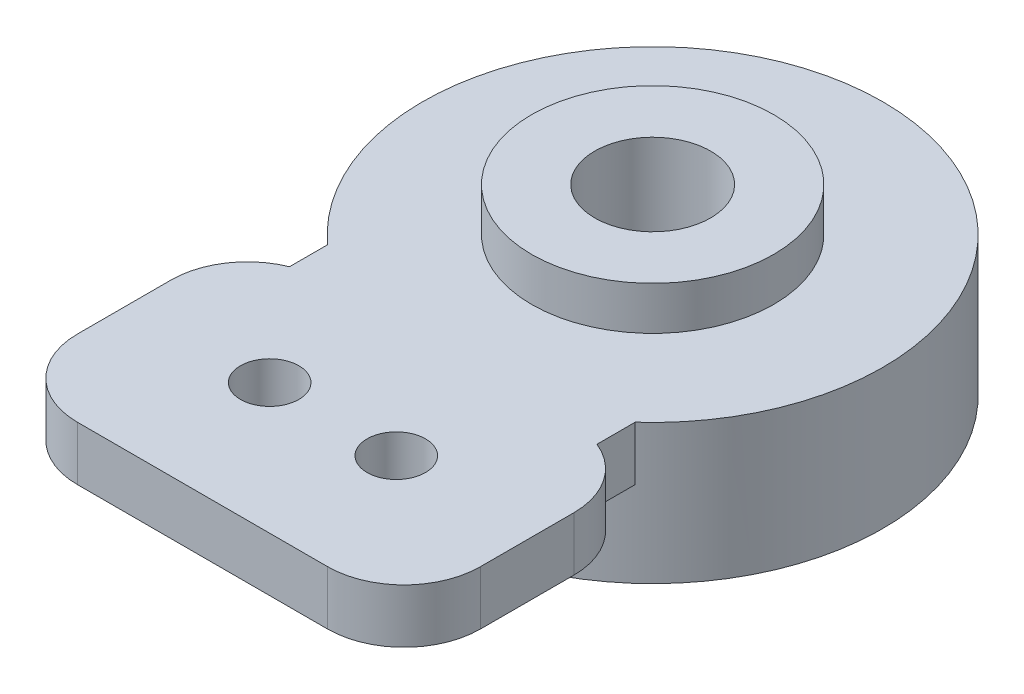
from build123d import *

# Parameters (mm, degrees)
BOSS_EXTRUDE1_DEPTH = 2.83
BOSS_EXTRUDE2_START = 4.48
SKETCH2_R           = 12.05
BOSS_EXTRUDE2_DEPTH = 4.48
SKETCH3_R           = 6.34
BOSS_EXTRUDE3_DEPTH = 2.27
SKETCH4_R           = 3.035
CUT_EXTRUDE1_DEPTH  = 29.151799232
SKETCH5_R           = 1.53
CUT_EXTRUDE2_DEPTH  = 28.46240157


with BuildPart() as part:
    # Sketch1 → Boss-Extrude1 (new body)
    with BuildSketch(Plane(origin=(0, 0, 0), x_dir=(1, 0, 0), z_dir=(0, 1, 0))):
        with BuildLine():
            Line((-6.55, -23.57), (6.55, -23.57))
            ThreePointArc((6.55, -23.57), (9.378427125, -22.398427125), (10.55, -19.57))
            Line((10.55, -19.57), (10.55, -14.674703952))
            ThreePointArc((10.55, -14.674703952), (9.86662479, -12.438635975), (8.05, -10.966604709))
            Line((8.05, -10.966604709), (8.05, -8.966604709))
            ThreePointArc((8.05, -8.966604709), (0, 12.05), (-8.05, -8.966604709))
            Line((-8.05, -8.966604709), (-8.05, -10.966604709))
            ThreePointArc((-8.05, -10.966604709), (-9.86662479, -12.438635975), (-10.55, -14.674703952))
            Line((-10.55, -14.674703952), (-10.55, -19.57))
            ThreePointArc((-10.55, -19.57), (-9.378427125, -22.398427125), (-6.55, -23.57))
        make_face()
    extrude(amount=BOSS_EXTRUDE1_DEPTH)

    # Sketch2 → Boss-Extrude2 (add)
    with BuildSketch(Plane.XZ.offset(BOSS_EXTRUDE2_START)):
        with Locations(Location((0, 0, 0), (0, 0, 270))):
            Circle(SKETCH2_R)
    extrude(amount=-BOSS_EXTRUDE2_DEPTH)

    # Sketch3 → Boss-Extrude3 (add)
    with BuildSketch(Plane(origin=(0, 2.83, 0), x_dir=(1, 0, 0), z_dir=(0, 1, 0))):
        with Locations(Location((0, 0, 0), (0, 0, 90))):
            Circle(SKETCH3_R)
    extrude(amount=BOSS_EXTRUDE3_DEPTH)

    # Sketch4 → Cut-Extrude1 (cut, through all)
    with BuildSketch(Plane(origin=(0, 5.1, 0), x_dir=(1, 0, 0), z_dir=(0, 1, 0))):
        with Locations(Location((0, 0, 0), (0, 0, 270))):
            Circle(SKETCH4_R)
    extrude(amount=-CUT_EXTRUDE1_DEPTH, mode=Mode.SUBTRACT)

    # Sketch5 → Cut-Extrude2 (cut, through all)
    with BuildSketch(Plane(origin=(0, 2.83, 0), x_dir=(1, 0, 0), z_dir=(0, 1, 0))):
        with Locations(Location((-3.315, -16.74, 0), (0, 0, 270))):
            Circle(SKETCH5_R)
        with Locations(Location((3.315, -16.74, 0), (0, 0, 270))):
            Circle(SKETCH5_R)
    extrude(amount=-CUT_EXTRUDE2_DEPTH, mode=Mode.SUBTRACT)


solid = part.part
